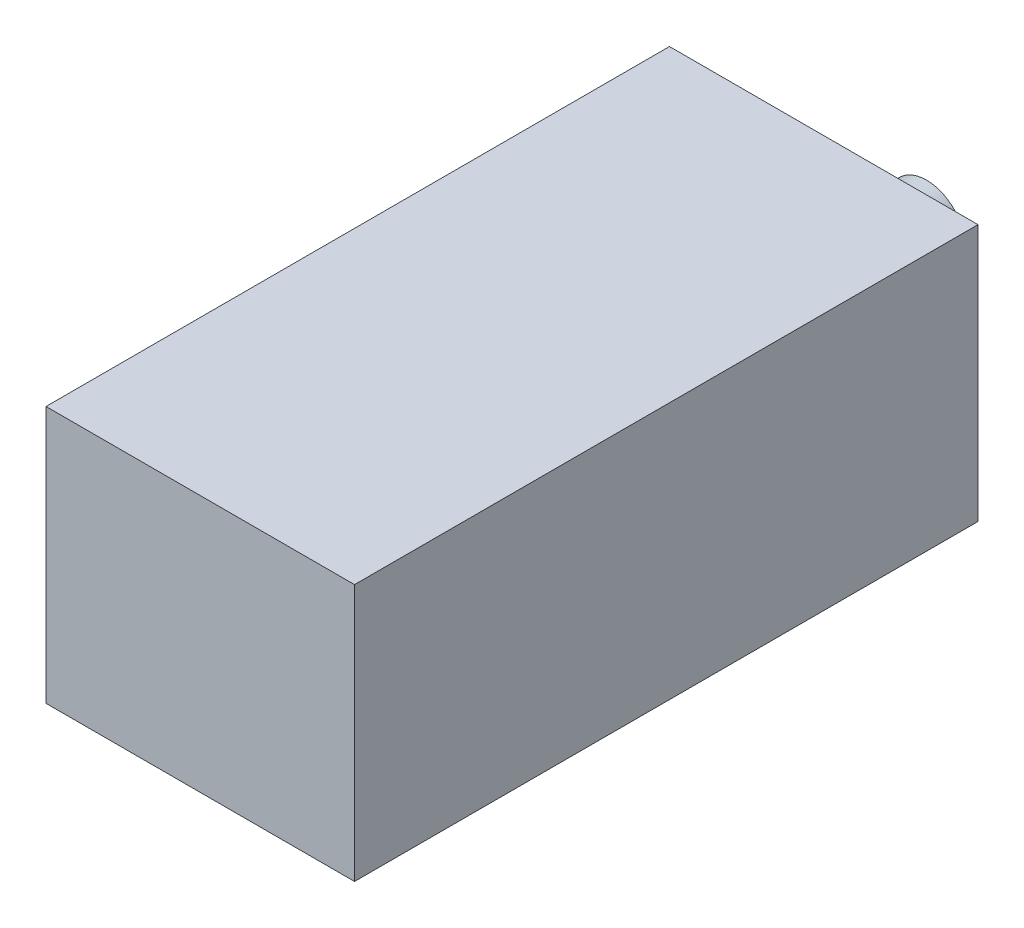
from build123d import *

# Parameters (mm, degrees)
SKETCH1_W           = 12
SKETCH1_H           = 10
BOSS_EXTRUDE1_DEPTH = 24.25
SKETCH2_R           = 0.5
CUT_EXTRUDE1_DEPTH  = 10
SKETCH3_R           = 1.5
BOSS_EXTRUDE2_DEPTH = 4


with BuildPart() as part:
    # Sketch1 → Boss-Extrude1 (new body)
    with BuildSketch(Plane.XY):
        with Locations((6, -5)):
            Rectangle(SKETCH1_W, SKETCH1_H)
    extrude(amount=BOSS_EXTRUDE1_DEPTH)

    # Sketch2 → Cut-Extrude1 (cut)
    with BuildSketch(Plane(origin=(0, 0, 0), x_dir=(-1, 0, 0), z_dir=(0, 0, -1))):
        with Locations((-10.5, -5)):
            Circle(SKETCH2_R)
        with Locations((-1.5, -5)):
            Circle(SKETCH2_R)
    extrude(amount=-CUT_EXTRUDE1_DEPTH, mode=Mode.SUBTRACT)

    # Sketch3 → Boss-Extrude2 (add)
    with BuildSketch(Plane(origin=(0, 0, 0), x_dir=(-1, 0, 0), z_dir=(0, 0, -1))):
        with Locations(Location((-6, -5, 0), (0, 0, 180))):
            Circle(SKETCH3_R)
    extrude(amount=BOSS_EXTRUDE2_DEPTH)


solid = part.part
